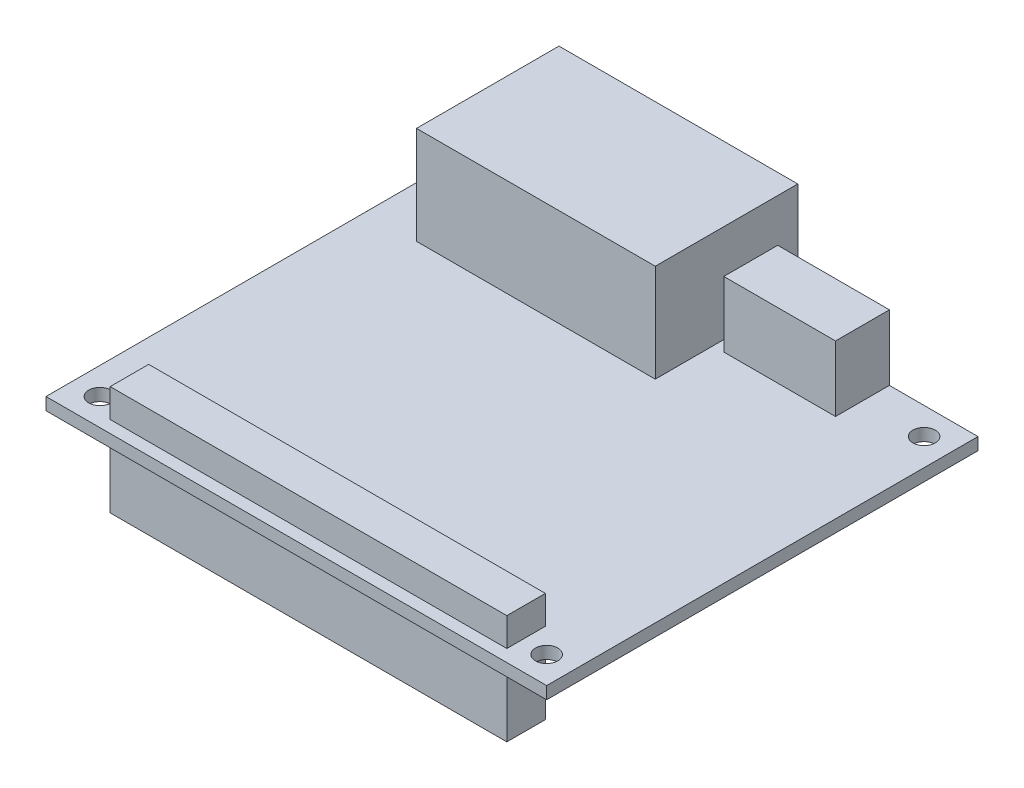
from build123d import *

# Parameters (mm, degrees)
ESQUISSE1_W             = 65
ESQUISSE1_H             = 56
BOSS_EXTRU_1_DEPTH      = 1.6
D_GAGEMENT_M2_51_D      = 2.9
ESQUISSE4_W             = 31
ESQUISSE4_H             = 18.5
BOSS_EXTRU_2_DEPTH      = 12.7
ESQUISSE5_W             = 14.5
ESQUISSE5_H             = 7
BOSS_EXTRU_3_DEPTH      = 8.5
BOSS_EXTRU_4_DEPTH      = 3.7
BOSS_EXTRU_4_DEPTH_BACK = 10.5
ESQUISSE6_W             = 51.5
ESQUISSE6_H             = 5


with BuildPart() as part:
    # Esquisse1 → Boss.-Extru.1 (new body)
    with BuildSketch(Plane(origin=(0, 0, 0), x_dir=(1, 0, 0), z_dir=(0, 1, 0))):
        Rectangle(ESQUISSE1_W, ESQUISSE1_H)
    extrude(amount=BOSS_EXTRU_1_DEPTH)

    # Dégagement M2.51 (through all)
    with Locations(Plane(origin=(0, 1.6, 0), x_dir=(1, 0, 0), z_dir=(0, 1, 0))):
        with Locations((-29, 24.5), (29, 24.5), (29, -24.5), (-29, -24.5)):
            Hole(D_GAGEMENT_M2_51_D / 2)


with BuildPart() as body_2:
    # Esquisse4 → Boss.-Extru.2 (new body)
    with BuildSketch(Plane(origin=(0, 1.6, 0), x_dir=(1, 0, 0), z_dir=(0, 1, 0))):
        with Locations((-10.4, 22.75)):
            Rectangle(ESQUISSE4_W, ESQUISSE4_H)
    extrude(amount=BOSS_EXTRU_2_DEPTH)


with BuildPart() as body_3:
    # Esquisse5 → Boss.-Extru.3 (new body)
    with BuildSketch(Plane(origin=(0, 1.6, 0), x_dir=(1, 0, 0), z_dir=(0, 1, 0))):
        with Locations((13.75, 24.5)):
            Rectangle(ESQUISSE5_W, ESQUISSE5_H)
    extrude(amount=BOSS_EXTRU_3_DEPTH)


with BuildPart() as body_4:
    # Esquisse6 → Boss.-Extru.4 (new, two sides: drawn at the far end of the back side and taken through both)
    with BuildSketch(Plane(origin=(0, 1.6, 0), x_dir=(1, 0, 0), z_dir=(0, 1, 0)).offset(-BOSS_EXTRU_4_DEPTH_BACK)):
        with Locations((0, -23.920055796)):
            Rectangle(ESQUISSE6_W, ESQUISSE6_H)
    extrude(amount=BOSS_EXTRU_4_DEPTH + BOSS_EXTRU_4_DEPTH_BACK)


solid = Compound([part.part, body_2.part, body_3.part, body_4.part])
